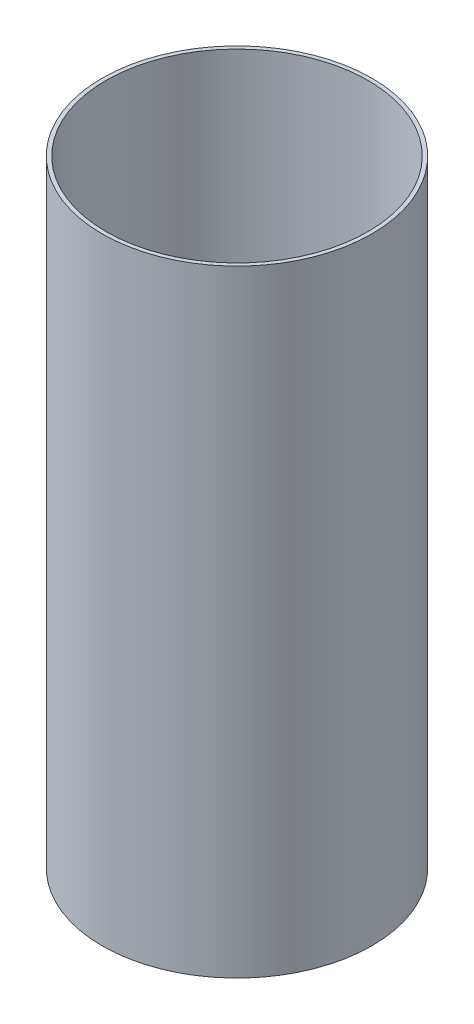
from build123d import *

# Parameters (mm, degrees)
SKETCH1_R           = 17.5
SKETCH1_R_2         = 17
BOSS_EXTRUDE1_DEPTH = 40


with BuildPart() as part:
    # Sketch1 → Boss-Extrude1 (new, symmetric)
    with BuildSketch(Plane(origin=(0, 0, 0), x_dir=(1, 0, 0), z_dir=(0, 1, 0))):
        with Locations(Location((0, 0, 0), (0, 0, 270))):
            Circle(SKETCH1_R)
        with Locations(Location((0, 0, 0), (0, 0, 270))):
            Circle(SKETCH1_R_2, mode=Mode.SUBTRACT)
    extrude(amount=BOSS_EXTRUDE1_DEPTH, both=True)


solid = part.part
